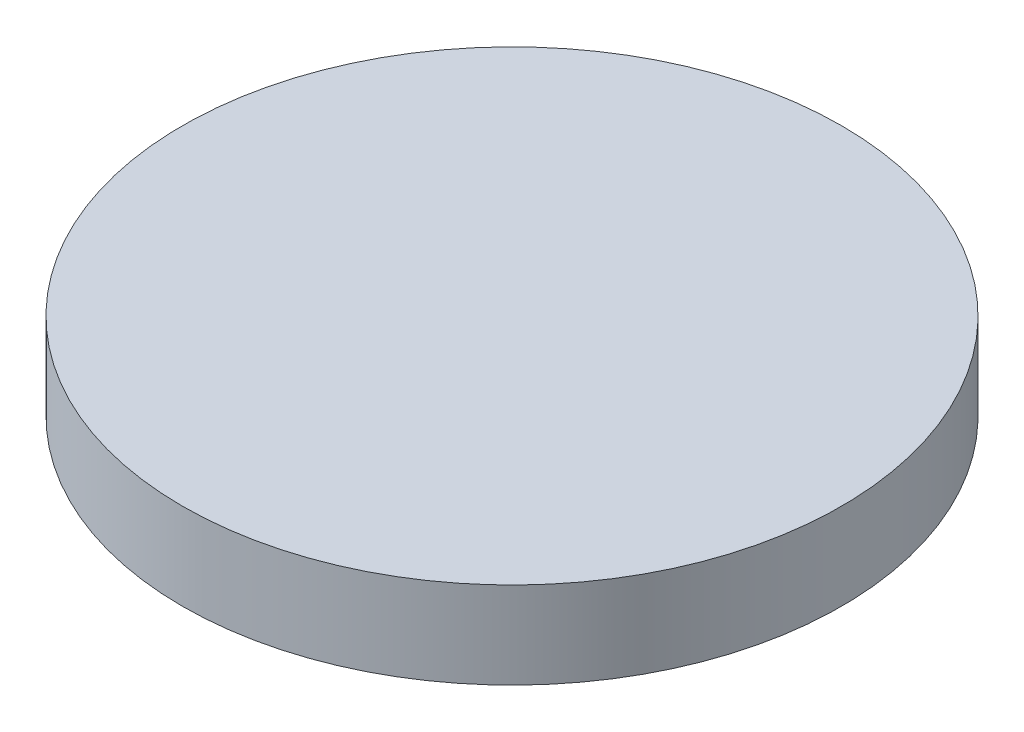
from build123d import *

# Parameters (mm, degrees)
SKETCH1_R           = 12.065
BOSS_EXTRUDE1_DEPTH = 3.175


with BuildPart() as part:
    # Sketch1 → Boss-Extrude1 (new body)
    with BuildSketch(Plane(origin=(0, 0, 0), x_dir=(1, 0, 0), z_dir=(0, 1, 0))):
        with Locations(Location((4.999655882, -4.961936119, 0), (0, 0, 270))):
            Circle(SKETCH1_R)
    extrude(amount=BOSS_EXTRUDE1_DEPTH)


solid = part.part
